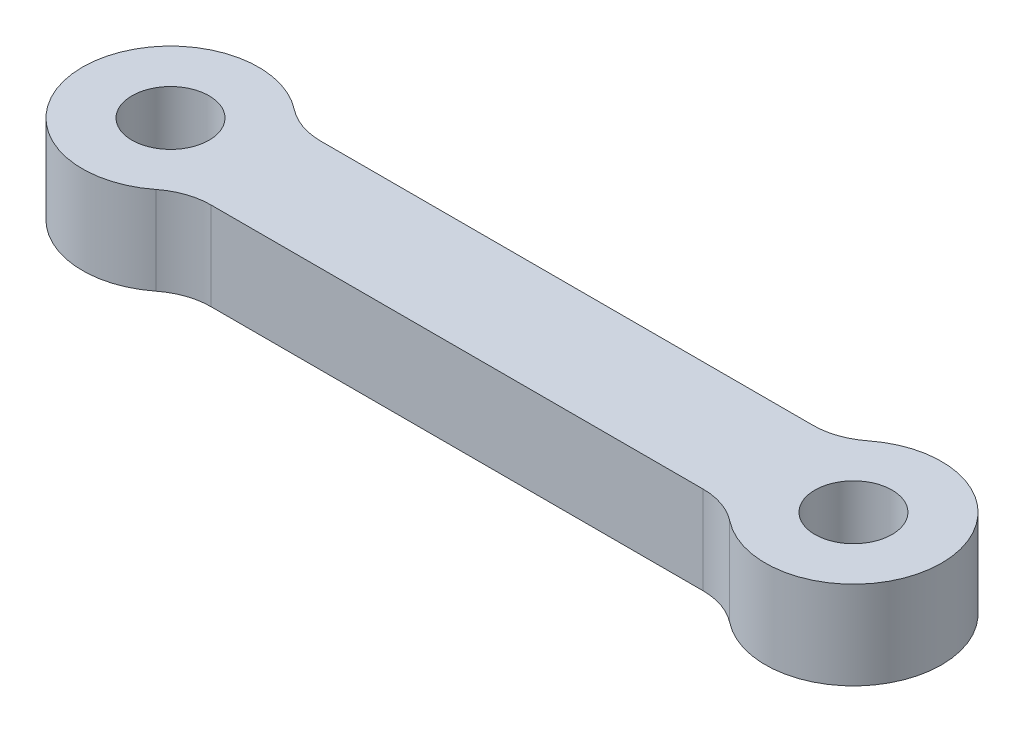
from build123d import *

# Parameters (mm, degrees)
SKETCH1_R           = 1.75
BOSS_EXTRUDE1_DEPTH = 4
FILLET1_R           = 3


with BuildPart() as part:
    # Sketch1 → Boss-Extrude1 (new body)
    with BuildSketch(Plane(origin=(0, 0, 0), x_dir=(1, 0, 0), z_dir=(0, 1, 0))):
        with BuildLine():
            Line((27.877501001, 2.5), (3.122498999, 2.5))
            ThreePointArc((3.122498999, 2.5), (-4, 0), (3.122498999, -2.5))
            Line((3.122498999, -2.5), (27.877501001, -2.5))
            ThreePointArc((27.877501001, -2.5), (35, 0), (27.877501001, 2.5))
        make_face()
        with Locations(Location((0, 0, 0), (0, 0, 270))):
            Circle(SKETCH1_R, mode=Mode.SUBTRACT)
        with Locations(Location((31, 0, 0), (0, 0, 270))):
            Circle(SKETCH1_R, mode=Mode.SUBTRACT)
    extrude(amount=BOSS_EXTRUDE1_DEPTH)

    # Fillet1
    fillet1_edges = [part.edges().sort_by_distance(p)[0] for p in [
        (27.877501001, 2, 2.5),
        (3.122498999, 2, 2.5),
        (3.122498999, 2, -2.5),
        (27.877501001, 2, -2.5),
    ]]
    fillet(fillet1_edges, radius=FILLET1_R)


solid = part.part
